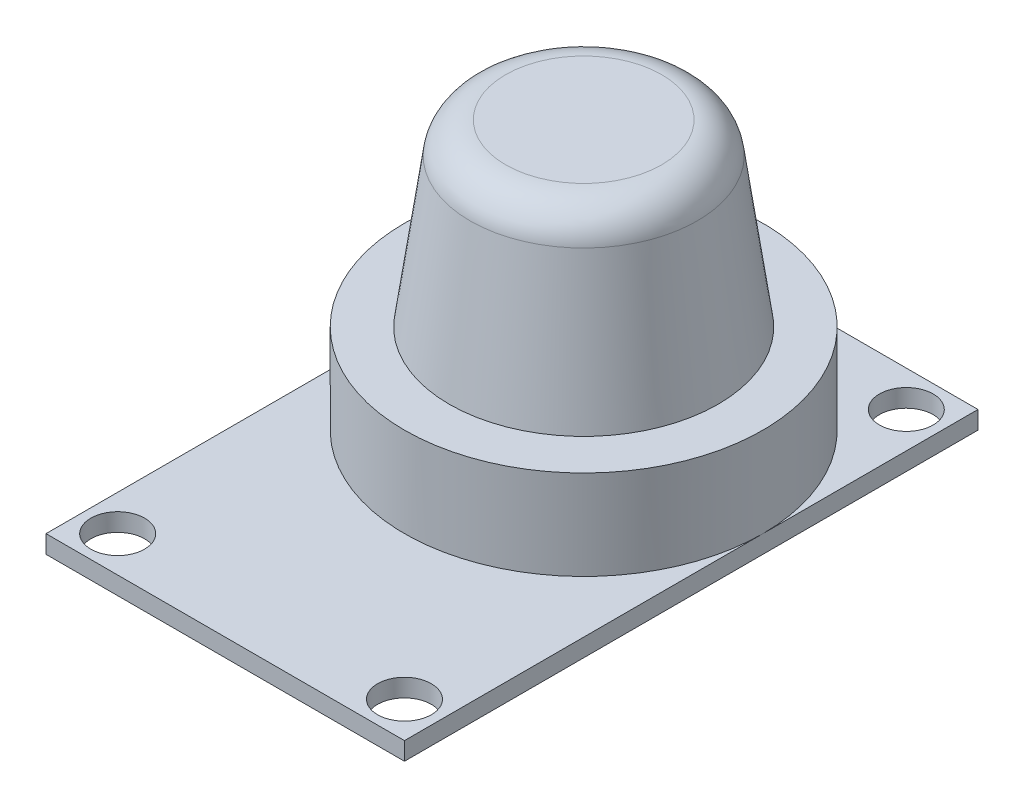
from build123d import *

# Parameters (mm, degrees)
SKETCH1_W           = 20
SKETCH1_H           = 32
BOSS_EXTRUDE1_DEPTH = 1
SKETCH2_R           = 10
BOSS_EXTRUDE2_DEPTH = 5
SKETCH3_R           = 1.5
CUT_EXTRUDE1_DEPTH  = 5
SKETCH4_R           = 7.5
BOSS_EXTRUDE3_DEPTH = 10
BOSS_EXTRUDE3_TAPER = 8
FILLET1_R           = 2


with BuildPart() as part:
    # Sketch1 → Boss-Extrude1 (new body)
    with BuildSketch(Plane(origin=(0, 0, 0), x_dir=(1, 0, 0), z_dir=(0, 1, 0))):
        Rectangle(SKETCH1_W, SKETCH1_H)
    extrude(amount=BOSS_EXTRUDE1_DEPTH)

    # Sketch2 → Boss-Extrude2 (add)
    with BuildSketch(Plane(origin=(0, 1, 0), x_dir=(1, 0, 0), z_dir=(0, 1, 0))):
        with Locations(Location((0, 4, 0), (0, 0, 180))):
            Circle(SKETCH2_R)
    extrude(amount=BOSS_EXTRUDE2_DEPTH)

    # Sketch3 → Cut-Extrude1 (cut)
    with BuildSketch(Plane(origin=(0, 1, 0), x_dir=(1, 0, 0), z_dir=(0, 1, 0))):
        with Locations(Location((8, 14, 0), (0, 0, 270))):
            Circle(SKETCH3_R)
        with Locations(Location((-8, 14, 0), (0, 0, 270))):
            Circle(SKETCH3_R)
        with Locations(Location((8, -14, 0), (0, 0, 270))):
            Circle(SKETCH3_R)
        with Locations(Location((-8, -14, 0), (0, 0, 270))):
            Circle(SKETCH3_R)
    extrude(amount=-CUT_EXTRUDE1_DEPTH, mode=Mode.SUBTRACT)

    # Sketch4 → Boss-Extrude3 (add)
    with BuildSketch(Plane(origin=(0, 6, 0), x_dir=(1, 0, 0), z_dir=(0, 1, 0))):
        with Locations((0, 4)):
            Circle(SKETCH4_R)
    extrude(amount=BOSS_EXTRUDE3_DEPTH, taper=BOSS_EXTRUDE3_TAPER)

    # Fillet1
    fillet1_edges = [part.edges().sort_by_distance(p)[0] for p in [
        (-6.094591653, 16, -4),
    ]]
    fillet(fillet1_edges, radius=FILLET1_R)


solid = part.part
